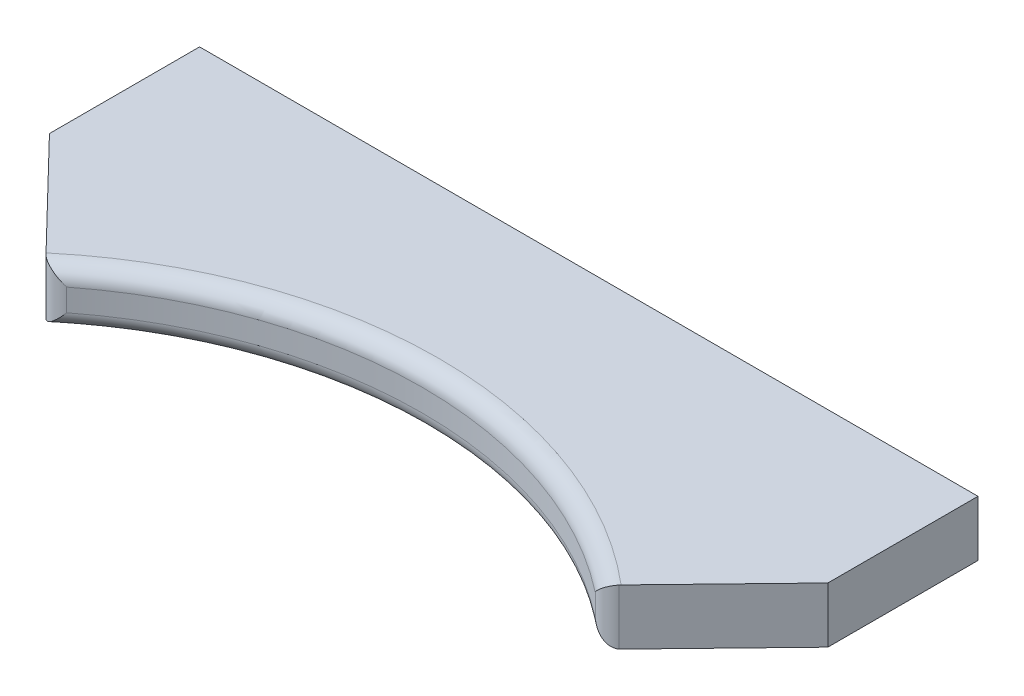
from build123d import *

# Parameters (mm, degrees)
BOSS_EXTRUDE1_DEPTH = 6.35
FILLET1_R           = 1.905


with BuildPart() as part:
    # Sketch1 → Boss-Extrude1 (new body)
    with BuildSketch(Plane(origin=(0, 0, 0), x_dir=(1, 0, 0), z_dir=(0, 1, 0))):
        with BuildLine():
            Line((-44.45, 68.072), (44.45, 68.072))
            Line((44.45, 68.072), (44.45, 50.927))
            Line((44.45, 50.927), (31.510734202, 37.553030691))
            ThreePointArc((31.510734202, 37.553030691), (0, 49.022), (-31.510734202, 37.553030691))
            Line((-31.510734202, 37.553030691), (-44.45, 50.927))
            Line((-44.45, 50.927), (-44.45, 68.072))
        make_face()
    extrude(amount=BOSS_EXTRUDE1_DEPTH)

    # Fillet1
    fillet1_edges = [part.edges().sort_by_distance(p)[0] for p in [
        (31.510734202, 3.175, -37.553030691),
        (-31.510734202, 3.175, -37.553030691),
        (0, 6.35, -49.022),
        (0, 0, -49.022),
    ]]
    fillet(fillet1_edges, radius=FILLET1_R)


solid = part.part
